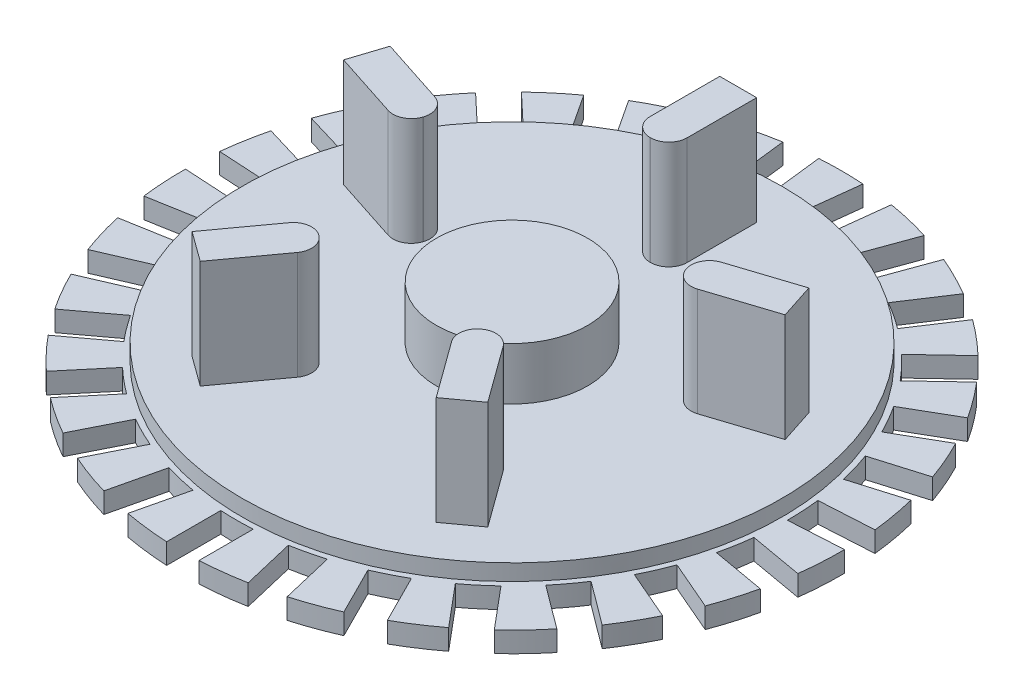
from build123d import *

# Parameters (mm, degrees)
SKETCH1_R           = 25
BOSS_EXTRUDE1_DEPTH = 1.5
BOSS_EXTRUDE2_DEPTH = 10
CIRPATTERN1_COUNT   = 5
SKETCH3_R           = 30.5
BOSS_EXTRUDE3_DEPTH = 1.9
CUT_EXTRUDE2_DEPTH  = 46.167023369
SKETCH5_R           = 7
BOSS_EXTRUDE4_DEPTH = 4.85


with BuildPart() as part:
    # Sketch1 → Boss-Extrude1 (new body)
    with BuildSketch(Plane(origin=(0, 0, 0), x_dir=(1, 0, 0), z_dir=(0, 1, 0))):
        with Locations(Location((0, 0, 0), (0, 0, 270))):
            Circle(SKETCH1_R)
    extrude(amount=BOSS_EXTRUDE1_DEPTH)

    # Sketch2 → Boss-Extrude2 (add)
    with BuildSketch(Plane(origin=(0, 1.5, 0), x_dir=(1, 0, 0), z_dir=(0, 1, 0))):
        with BuildLine():
            Line((-1.7088, 14.499997994), (-1.7088, 19.299997994))
            Line((-1.7088, 19.299997994), (-1.7088, 20.930360784))
            Line((-1.7088, 20.930360784), (1.7088, 20.930360784))
            Line((1.7088, 20.930360784), (1.7088, 19.299997994))
            Line((1.7088, 19.299997994), (1.7088, 14.499997994))
            ThreePointArc((1.7088, 14.499997994), (1.210881528, 13.297916466), (0.0088, 12.799997994))
            Line((0.0088, 12.799997994), (-0.0088, 12.799997994))
            ThreePointArc((-0.0088, 12.799997994), (-1.210881528, 13.297916466), (-1.7088, 14.499997994))
        make_face()
    boss_extrude2 = extrude(amount=BOSS_EXTRUDE2_DEPTH)

    # CirPattern1: Boss-Extrude2 ×5 about axis
    cirpattern1_axis = Axis((0, 0, 0), (0, 1, 0))
    for i in range(1, CIRPATTERN1_COUNT):
        add(boss_extrude2.rotate(cirpattern1_axis, i * 360 / CIRPATTERN1_COUNT))

    # Sketch3 → Boss-Extrude3 (add)
    with BuildSketch(Plane.XZ):
        with Locations(Location((0, 0, 0), (0, 0, 90))):
            Circle(SKETCH3_R)
    extrude(amount=BOSS_EXTRUDE3_DEPTH)

    # Sketch4 → Cut-Extrude2 (cut, through all)
    with BuildSketch(Plane.XZ.offset(1.9)):
        with BuildLine():
            Line((-1.5, 30.963688411), (-1.5, 25.455844123))
            ThreePointArc((-1.5, 25.455844123), (0, 25.5), (1.5, 25.455844123))
            Line((1.5, 25.455844123), (1.5, 30.963688411))
            ThreePointArc((1.5, 30.963688411), (0, 31), (-1.5, 30.963688411))
        make_face()
        with BuildLine():
            Line((5.681150658, 30.474981988), (4.410954352, 25.115602356))
            ThreePointArc((4.410954352, 25.115602356), (5.880704704, 24.8126442), (7.330088964, 24.423754744))
            Line((7.330088964, 24.423754744), (8.60028527, 29.783134376))
            ThreePointArc((8.60028527, 29.783134376), (7.149091993, 30.164390988), (5.681150658, 30.474981988))
        make_face()
        with BuildLine():
            Line((12.556029014, 28.343361399), (10.084113013, 23.421371965))
            ThreePointArc((10.084113013, 23.421371965), (11.444379095, 22.787632328), (12.765010934, 22.074974425))
            Line((12.765010934, 22.074974425), (15.236926935, 26.996963858))
            ThreePointArc((15.236926935, 26.996963858), (13.912774586, 27.70261185), (12.556029014, 28.343361399))
        make_face()
        with BuildLine():
            Line((18.754008596, 24.68374286), (15.213634532, 20.46448935))
            ThreePointArc((15.213634532, 20.46448935), (16.391084047, 19.5341333), (17.511767861, 18.536126521))
            Line((17.511767861, 18.536126521), (21.052141925, 22.755380031))
            ThreePointArc((21.052141925, 22.755380031), (19.9264159, 23.747377737), (18.754008596, 24.68374286))
        make_face()
        with BuildLine():
            Line((23.94095472, 19.693417354), (19.522985074, 16.404360816))
            ThreePointArc((19.522985074, 16.404360816), (20.454141415, 15.227544088), (21.31446085, 13.997991238))
            Line((21.31446085, 13.997991238), (25.732430495, 17.287047776))
            ThreePointArc((25.732430495, 17.287047776), (24.865818975, 18.511916343), (23.94095472, 19.693417354))
        make_face()
        with BuildLine():
            Line((27.837237778, 13.641414622), (22.779846439, 11.459868945))
            ThreePointArc((22.779846439, 11.459868945), (23.414510725, 10.100034034), (23.968085737, 8.705220624))
            Line((23.968085737, 8.705220624), (29.025477076, 10.886766301))
            ThreePointArc((29.025477076, 10.886766301), (28.464699313, 12.278472747), (27.837237778, 13.641414622))
        make_face()
        with BuildLine():
            Line((30.232808142, 6.853999696), (24.808640385, 5.897572572))
            ThreePointArc((24.808640385, 5.897572572), (25.112597702, 4.428028531), (25.329584918, 2.943149313))
            Line((25.329584918, 2.943149313), (30.753752675, 3.899576437))
            ThreePointArc((30.753752675, 3.899576437), (30.529040343, 5.383093508), (30.232808142, 6.853999696))
        make_face()
        with BuildLine():
            Line((30.998519994, -0.302916128), (25.499994107, 0.017336536))
            ThreePointArc((25.499994107, 0.017336536), (25.456858036, -1.482693137), (25.32555962, -2.977587939))
            Line((25.32555962, -2.977587939), (30.824085507, -3.297840602))
            ThreePointArc((30.824085507, -3.297840602), (30.947552906, -1.802489696), (30.998519994, -0.302916128))
        make_face()
        with BuildLine():
            Line((30.093093609, -7.443501664), (24.816636546, -5.863834117))
            ThreePointArc((24.816636546, -5.863834117), (24.428732564, -7.313482434), (23.956226848, -8.737802654))
            Line((23.956226848, -8.737802654), (29.232683911, -10.317470201))
            ThreePointArc((29.232683911, -10.317470201), (29.697674882, -8.890900214), (30.093093609, -7.443501664))
        make_face()
        with BuildLine():
            Line((27.565340759, -14.1828061), (22.795407685, -11.428883956))
            ThreePointArc((22.795407685, -11.428883956), (22.083647797, -12.75), (21.295407685, -14.026960167))
            Line((21.295407685, -14.026960167), (26.065340759, -16.780882311))
            ThreePointArc((26.065340759, -16.780882311), (26.846787517, -15.5), (27.565340759, -14.1828061))
        make_face()
        with BuildLine():
            Line((23.551533253, -20.157511787), (19.545272496, -16.377799702))
            ThreePointArc((19.545272496, -16.377799702), (18.54802786, -17.499161766), (17.486547582, -18.559920626))
            Line((17.486547582, -18.559920626), (21.492808339, -22.339632712))
            ThreePointArc((21.492808339, -22.339632712), (22.548582889, -21.273490774), (23.551533253, -20.157511787))
        make_face()
        with BuildLine():
            Line((18.268056493, -25.045520796), (15.241446607, -20.443784027))
            ThreePointArc((15.241446607, -20.443784027), (14.012478941, -21.304939191), (12.734983173, -22.092310961))
            Line((12.734983173, -22.092310961), (15.761593059, -26.694047731))
            ThreePointArc((15.761593059, -26.694047731), (17.03477832, -25.900122154), (18.268056493, -25.045520796))
        make_face()
        with BuildLine():
            Line((11.999744079, -28.583319297), (10.115950387, -23.407638663))
            ThreePointArc((10.115950387, -23.407638663), (8.721513655, -23.96216183), (7.296872524, -24.433699093))
            Line((7.296872524, -24.433699093), (9.180666217, -29.609379727))
            ThreePointArc((9.180666217, -29.609379727), (10.602624443, -29.130471244), (11.999744079, -28.583319297))
        make_face()
        with BuildLine():
            Line((5.084522356, -30.580183656), (4.445100662, -25.10958144))
            ThreePointArc((4.445100662, -25.10958144), (2.96036931, -25.327578122), (1.465385589, -25.457860183))
            Line((1.465385589, -25.457860183), (2.104807283, -30.928462398))
            ThreePointArc((2.104807283, -30.928462398), (3.598880338, -30.79038909), (5.084522356, -30.580183656))
        make_face()
        with BuildLine():
            Line((-2.104807283, -30.928462398), (-1.465385589, -25.457860183))
            ThreePointArc((-1.465385589, -25.457860183), (-2.96036931, -25.327578122), (-4.445100662, -25.10958144))
            Line((-4.445100662, -25.10958144), (-5.084522356, -30.580183656))
            ThreePointArc((-5.084522356, -30.580183656), (-3.598880338, -30.79038909), (-2.104807283, -30.928462398))
        make_face()
        with BuildLine():
            Line((-9.180666217, -29.609379727), (-7.296872524, -24.433699093))
            ThreePointArc((-7.296872524, -24.433699093), (-8.721513655, -23.96216183), (-10.115950387, -23.407638663))
            Line((-10.115950387, -23.407638663), (-11.999744079, -28.583319297))
            ThreePointArc((-11.999744079, -28.583319297), (-10.602624443, -29.130471244), (-9.180666217, -29.609379727))
        make_face()
        with BuildLine():
            Line((-15.761593059, -26.694047731), (-12.734983173, -22.092310961))
            ThreePointArc((-12.734983173, -22.092310961), (-14.012478941, -21.304939191), (-15.241446607, -20.443784027))
            Line((-15.241446607, -20.443784027), (-18.268056493, -25.045520796))
            ThreePointArc((-18.268056493, -25.045520796), (-17.03477832, -25.900122154), (-15.761593059, -26.694047731))
        make_face()
        with BuildLine():
            Line((-21.492808339, -22.339632712), (-17.486547582, -18.559920626))
            ThreePointArc((-17.486547582, -18.559920626), (-18.54802786, -17.499161766), (-19.545272496, -16.377799702))
            Line((-19.545272496, -16.377799702), (-23.551533253, -20.157511787))
            ThreePointArc((-23.551533253, -20.157511787), (-22.548582889, -21.273490774), (-21.492808339, -22.339632712))
        make_face()
        with BuildLine():
            Line((-26.065340759, -16.780882311), (-21.295407685, -14.026960167))
            ThreePointArc((-21.295407685, -14.026960167), (-22.083647797, -12.75), (-22.795407685, -11.428883956))
            Line((-22.795407685, -11.428883956), (-27.565340759, -14.1828061))
            ThreePointArc((-27.565340759, -14.1828061), (-26.846787517, -15.5), (-26.065340759, -16.780882311))
        make_face()
        with BuildLine():
            Line((-29.232683911, -10.317470201), (-23.956226848, -8.737802654))
            ThreePointArc((-23.956226848, -8.737802654), (-24.428732564, -7.313482434), (-24.816636546, -5.863834117))
            Line((-24.816636546, -5.863834117), (-30.093093609, -7.443501664))
            ThreePointArc((-30.093093609, -7.443501664), (-29.697674882, -8.890900214), (-29.232683911, -10.317470201))
        make_face()
        with BuildLine():
            Line((-30.824085507, -3.297840602), (-25.32555962, -2.977587939))
            ThreePointArc((-25.32555962, -2.977587939), (-25.456858036, -1.482693137), (-25.499994107, 0.017336536))
            Line((-25.499994107, 0.017336536), (-30.998519994, -0.302916128))
            ThreePointArc((-30.998519994, -0.302916128), (-30.947552906, -1.802489696), (-30.824085507, -3.297840602))
        make_face()
        with BuildLine():
            Line((-30.753752675, 3.899576437), (-25.329584918, 2.943149313))
            ThreePointArc((-25.329584918, 2.943149313), (-25.112597702, 4.428028531), (-24.808640385, 5.897572572))
            Line((-24.808640385, 5.897572572), (-30.232808142, 6.853999696))
            ThreePointArc((-30.232808142, 6.853999696), (-30.529040343, 5.383093508), (-30.753752675, 3.899576437))
        make_face()
        with BuildLine():
            Line((-29.025477076, 10.886766301), (-23.968085737, 8.705220624))
            ThreePointArc((-23.968085737, 8.705220624), (-23.414510725, 10.100034034), (-22.779846439, 11.459868945))
            Line((-22.779846439, 11.459868945), (-27.837237778, 13.641414622))
            ThreePointArc((-27.837237778, 13.641414622), (-28.464699313, 12.278472747), (-29.025477076, 10.886766301))
        make_face()
        with BuildLine():
            Line((-25.732430495, 17.287047776), (-21.31446085, 13.997991238))
            ThreePointArc((-21.31446085, 13.997991238), (-20.454141415, 15.227544088), (-19.522985074, 16.404360816))
            Line((-19.522985074, 16.404360816), (-23.94095472, 19.693417354))
            ThreePointArc((-23.94095472, 19.693417354), (-24.865818975, 18.511916343), (-25.732430495, 17.287047776))
        make_face()
        with BuildLine():
            Line((-21.052141925, 22.755380031), (-17.511767861, 18.536126521))
            ThreePointArc((-17.511767861, 18.536126521), (-16.391084047, 19.5341333), (-15.213634532, 20.46448935))
            Line((-15.213634532, 20.46448935), (-18.754008596, 24.68374286))
            ThreePointArc((-18.754008596, 24.68374286), (-19.9264159, 23.747377737), (-21.052141925, 22.755380031))
        make_face()
        with BuildLine():
            Line((-15.236926935, 26.996963858), (-12.765010934, 22.074974425))
            ThreePointArc((-12.765010934, 22.074974425), (-11.444379095, 22.787632328), (-10.084113013, 23.421371965))
            Line((-10.084113013, 23.421371965), (-12.556029014, 28.343361399))
            ThreePointArc((-12.556029014, 28.343361399), (-13.912774586, 27.70261185), (-15.236926935, 26.996963858))
        make_face()
        with BuildLine():
            Line((-8.60028527, 29.783134376), (-7.330088964, 24.423754744))
            ThreePointArc((-7.330088964, 24.423754744), (-5.880704704, 24.8126442), (-4.410954352, 25.115602356))
            Line((-4.410954352, 25.115602356), (-5.681150658, 30.474981988))
            ThreePointArc((-5.681150658, 30.474981988), (-7.149091993, 30.164390988), (-8.60028527, 29.783134376))
        make_face()
    extrude(amount=-CUT_EXTRUDE2_DEPTH, mode=Mode.SUBTRACT)

    # Sketch5 → Boss-Extrude4 (add)
    with BuildSketch(Plane(origin=(0, 1.5, 0), x_dir=(1, 0, 0), z_dir=(0, 1, 0))):
        with Locations(Location((0, 0, 0), (0, 0, 270))):
            Circle(SKETCH5_R)
    extrude(amount=BOSS_EXTRUDE4_DEPTH)


solid = part.part
